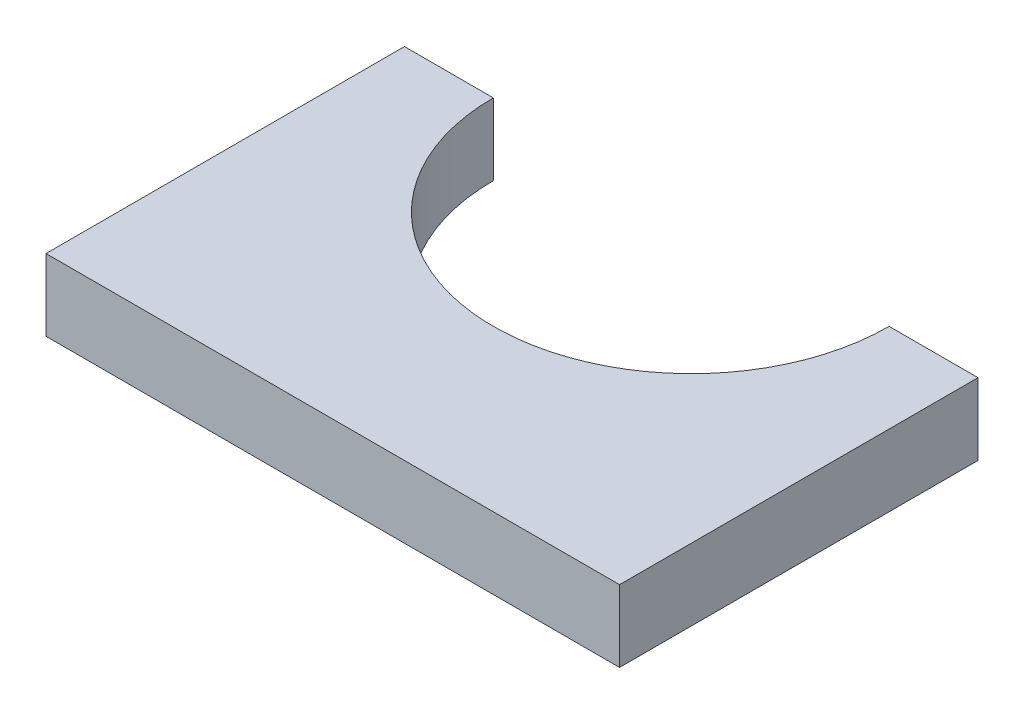
from build123d import *

# Parameters (mm, degrees)
SKETCH1_W           = 50.8
SKETCH1_H           = 31.75
BOSS_EXTRUDE1_DEPTH = 6.35
CUT_EXTRUDE1_DEPTH  = 6.35


with BuildPart() as part:
    # Sketch1 → Boss-Extrude1 (new body)
    with BuildSketch(Plane(origin=(0, 0, 0), x_dir=(1, 0, 0), z_dir=(0, 1, 0))):
        Rectangle(SKETCH1_W, SKETCH1_H)
    extrude(amount=BOSS_EXTRUDE1_DEPTH)

    # Sketch2 → Cut-Extrude1 (cut)
    with BuildSketch(Plane(origin=(0, 6.35, 0), x_dir=(1, 0, 0), z_dir=(0, 1, 0))):
        with BuildLine():
            Line((-17.526, 15.875), (17.526, 15.875))
            ThreePointArc((17.526, 15.875), (0, -1.651), (-17.526, 15.875))
        make_face()
    extrude(amount=-CUT_EXTRUDE1_DEPTH, mode=Mode.SUBTRACT)


solid = part.part
